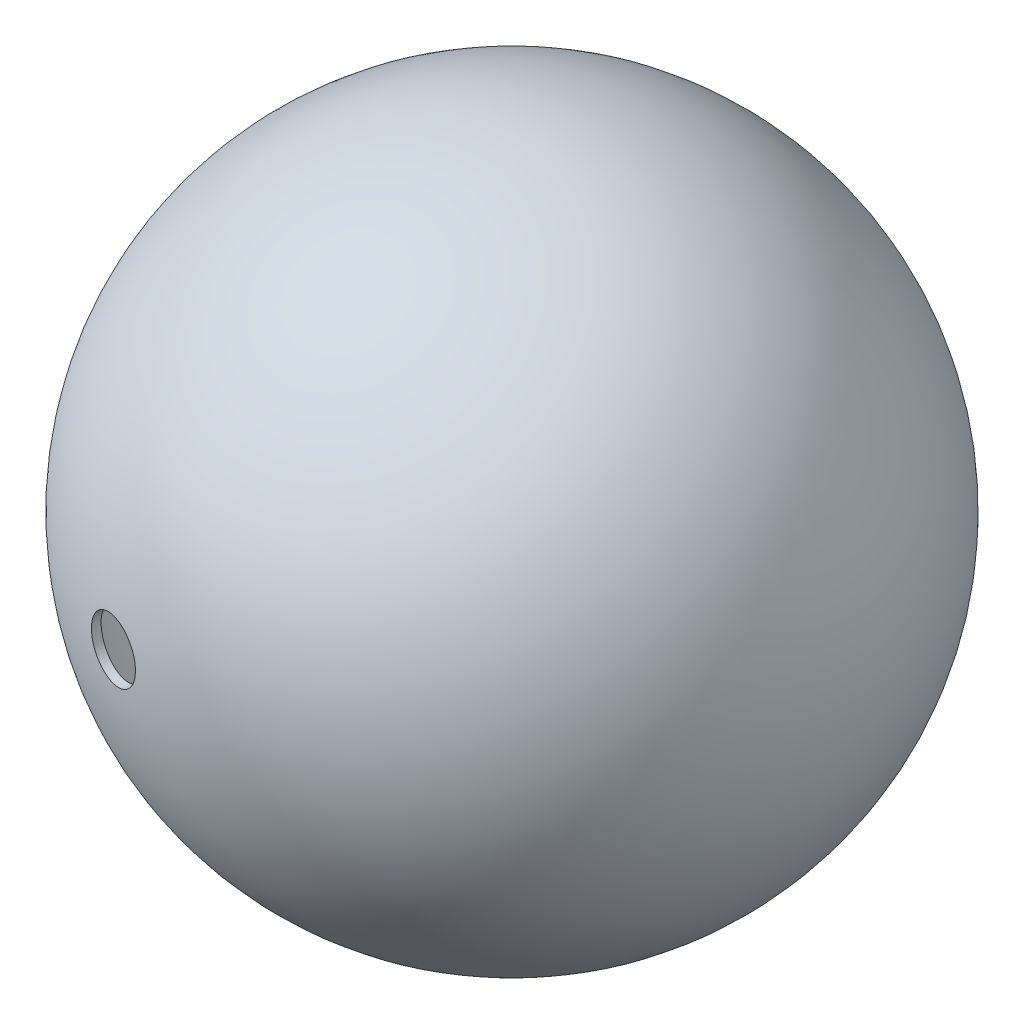
from build123d import *

# Parameters (mm, degrees)
SKETCH2_R          = 1.1
CUT_EXTRUDE1_DEPTH = 100


with BuildPart() as part:
    # Sketch1 → Revolve1 (revolve)
    with BuildSketch(Plane.XY):
        with BuildLine():
            ThreePointArc((0, -12.33), (12.33, 0), (0, 12.33))
            Line((0, 12.33), (0, 11.99))
            ThreePointArc((0, 11.99), (11.99, 0), (0, -11.99))
            Line((0, -11.99), (0, -12.33))
        make_face()
    revolve(axis=Axis((0, 12.757321135, 0), (0, -1, 0)))

    # Sketch2 → Cut-Extrude1 (cut)
    with BuildSketch(Plane.XY):
        with Locations((-3, 0)):
            Circle(SKETCH2_R)
    extrude(amount=CUT_EXTRUDE1_DEPTH, mode=Mode.SUBTRACT)

    # Sketch3 → Cut-Revolve1 (revolve, cut)
    with BuildSketch(Plane(origin=(0, 0, 0), x_dir=(1, 0, 0), z_dir=(0, 1, 0))):
        with BuildLine():
            ThreePointArc((0, 8.6), (3, 11.6), (0, 14.6))
            Line((0, 14.6), (0, 8.6))
        make_face()
    revolve(axis=Axis((0, 0, -15.098318445), (0, 0, 1)), mode=Mode.SUBTRACT)


solid = part.part
